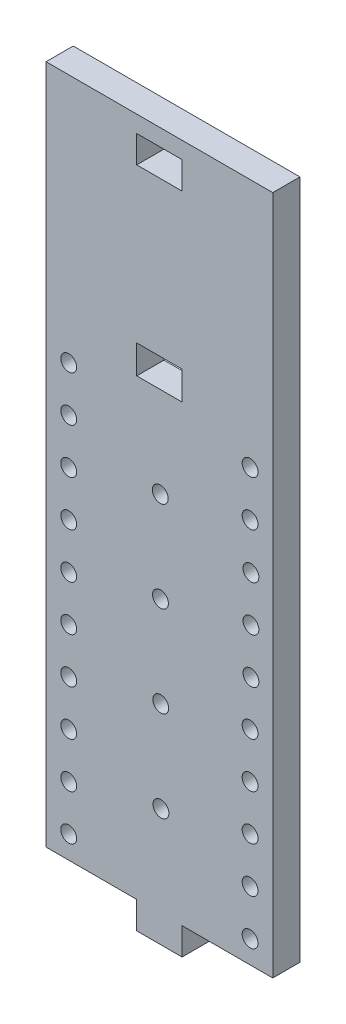
from build123d import *

# Parameters (mm, degrees)
ESBO_O1_W                = 50
ESBO_O1_H                = 150
RESSALTO_EXTRUS_O1_DEPTH = 6
ESBO_O2_R                = 1.75
CORTE_EXTRUS_O1_DEPTH    = 6
ESBO_O3_W                = 10
ESBO_O3_H                = 6
RESSALTO_EXTRUS_O2_DEPTH = 6
ESBO_O4_W                = 10
ESBO_O4_H                = 6.295380903
CORTE_EXTRUS_O2_DEPTH    = 6
ESBO_O5_W                = 10
ESBO_O5_H                = 6
CORTE_EXTRUS_O3_DEPTH    = 6


with BuildPart() as part:
    # Esboço1 → Ressalto-extrusão1 (new body)
    with BuildSketch(Plane.XY):
        with Locations((-0.394283087, 75)):
            Rectangle(ESBO_O1_W, ESBO_O1_H)
    extrude(amount=RESSALTO_EXTRUS_O1_DEPTH)

    # Esboço2 → Corte-extrusão1 (cut)
    with BuildSketch(Plane.XY.offset(6)):
        with Locations((-20.394283087, 95)):
            Circle(ESBO_O2_R)
        with Locations((-20.394283087, 85)):
            Circle(ESBO_O2_R)
        with Locations((-20.394283087, 75)):
            Circle(ESBO_O2_R)
        with Locations((-20.394283087, 65)):
            Circle(ESBO_O2_R)
        with Locations((-20.394283087, 55)):
            Circle(ESBO_O2_R)
        with Locations((-20.394283087, 45)):
            Circle(ESBO_O2_R)
        with Locations((-20.394283087, 35)):
            Circle(ESBO_O2_R)
        with Locations((-20.394283087, 25)):
            Circle(ESBO_O2_R)
        with Locations((-20.394283087, 15)):
            Circle(ESBO_O2_R)
        with Locations((-20.394283087, 5)):
            Circle(ESBO_O2_R)
        with Locations((19.605716913, 95)):
            Circle(ESBO_O2_R)
        with Locations((19.605716913, 85)):
            Circle(ESBO_O2_R)
        with Locations((19.793101921, 75)):
            Circle(ESBO_O2_R)
        with Locations((19.793101921, 65)):
            Circle(ESBO_O2_R)
        with Locations((19.793101921, 55)):
            Circle(ESBO_O2_R)
        with Locations((19.605716913, 45)):
            Circle(ESBO_O2_R)
        with Locations((19.605716913, 35)):
            Circle(ESBO_O2_R)
        with Locations((19.605716913, 25)):
            Circle(ESBO_O2_R)
        with Locations((19.605716913, 15)):
            Circle(ESBO_O2_R)
        with Locations((19.605716913, 5)):
            Circle(ESBO_O2_R)
        with Locations((-0.052571078, 20)):
            Circle(ESBO_O2_R)
        with Locations((-0.210284313, 80)):
            Circle(ESBO_O2_R)
        with Locations((-0.105142156, 40)):
            Circle(ESBO_O2_R)
        with Locations((-0.157713235, 60)):
            Circle(ESBO_O2_R)
    extrude(amount=-CORTE_EXTRUS_O1_DEPTH, mode=Mode.SUBTRACT)

    # Esboço3 → Ressalto-extrusão2 (add)
    with BuildSketch(Plane(origin=(0, 0, 0), x_dir=(-1, 0, 0), z_dir=(0, -1, 0))):
        with Locations((0.394283087, -3)):
            Rectangle(ESBO_O3_W, ESBO_O3_H)
    extrude(amount=RESSALTO_EXTRUS_O2_DEPTH)

    # Esboço4 → Corte-extrusão2 (cut)
    with BuildSketch(Plane.XY.offset(6)):
        with Locations((-0.394283087, 103.147690452)):
            Rectangle(ESBO_O4_W, ESBO_O4_H)
    extrude(amount=-CORTE_EXTRUS_O2_DEPTH, mode=Mode.SUBTRACT)

    # Esboço5 → Corte-extrusão3 (cut)
    with BuildSketch(Plane.XY.offset(6)):
        with Locations((-0.394283087, 143.295380903)):
            Rectangle(ESBO_O5_W, ESBO_O5_H)
    extrude(amount=-CORTE_EXTRUS_O3_DEPTH, mode=Mode.SUBTRACT)


solid = part.part
